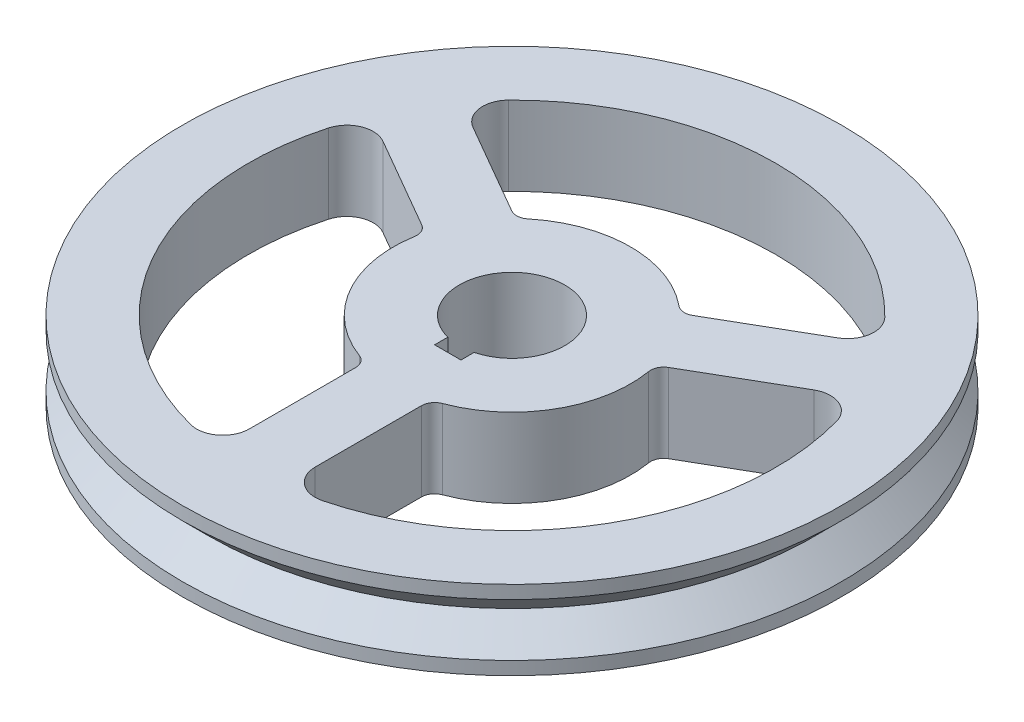
from build123d import *

# Parameters (mm, degrees)
SKETCH1_R           = 125
BOSS_EXTRUDE1_DEPTH = 15


with BuildPart() as part:
    # Sketch1 → Boss-Extrude1 (new, symmetric)
    with BuildSketch(Plane(origin=(0, 0, 0), x_dir=(1, 0, 0), z_dir=(0, 1, 0))):
        with Locations(Location((0, 0, 0), (0, 0, 270))):
            Circle(SKETCH1_R)
        with BuildLine():
            Line((34.312451849, 34.244060041), (69.217294241, 54.396380192))
            ThreePointArc((69.217294241, 54.396380192), (74.125688388, 61.706180446), (71.352549156, 70.062926922))
            ThreePointArc((71.352549156, 70.062926922), (0, 100), (-71.352549156, 70.062926922))
            ThreePointArc((-71.352549156, 70.062926922), (-74.125688388, 61.706180446), (-69.217294241, 54.396380192))
            Line((-69.217294241, 54.396380192), (-34.312451849, 34.244060041))
            ThreePointArc((-34.312451849, 34.244060041), (-31.397859232, 33.591405411), (-28.631206664, 34.716768354))
            ThreePointArc((-28.631206664, 34.716768354), (0, 45), (28.631206664, 34.716768354))
            ThreePointArc((28.631206664, 34.716768354), (31.397859232, 33.591405411), (34.312451849, 34.244060041))
        make_face(mode=Mode.SUBTRACT)
        with BuildLine():
            Line((-12.5, -46.837484988), (-12.5, -87.14212529))
            ThreePointArc((-12.5, -87.14212529), (-16.376275643, -95.04781944), (-25, -96.824583655))
            ThreePointArc((-25, -96.824583655), (-86.602540378, -50), (-96.352549156, 26.761656733))
            ThreePointArc((-96.352549156, 26.761656733), (-90.501964031, 33.341638994), (-81.717294241, 32.745745098))
            Line((-81.717294241, 32.745745098), (-46.812451849, 12.593424947))
            ThreePointArc((-46.812451849, 12.593424947), (-44.789940051, 10.395641014), (-44.381206664, 7.436968135))
            ThreePointArc((-44.381206664, 7.436968135), (-38.97114317, -22.5), (-15.75, -42.153736489))
            ThreePointArc((-15.75, -42.153736489), (-13.392080819, -43.987046425), (-12.5, -46.837484988))
        make_face(mode=Mode.SUBTRACT)
        with BuildLine():
            Line((12.5, -46.837484988), (12.5, -87.14212529))
            ThreePointArc((12.5, -87.14212529), (16.376275643, -95.04781944), (25, -96.824583655))
            ThreePointArc((25, -96.824583655), (86.602540378, -50), (96.352549156, 26.761656733))
            ThreePointArc((96.352549156, 26.761656733), (90.501964031, 33.341638994), (81.717294241, 32.745745098))
            Line((81.717294241, 32.745745098), (46.812451849, 12.593424947))
            ThreePointArc((46.812451849, 12.593424947), (44.789940051, 10.395641014), (44.381206664, 7.436968135))
            ThreePointArc((44.381206664, 7.436968135), (38.97114317, -22.5), (15.75, -42.153736489))
            ThreePointArc((15.75, -42.153736489), (13.392080819, -43.987046425), (12.5, -46.837484988))
        make_face(mode=Mode.SUBTRACT)
        with BuildLine():
            Line((-5, -19.364916731), (-5, -24.364916731))
            Line((-5, -24.364916731), (5, -24.364916731))
            Line((5, -24.364916731), (5, -19.364916731))
            ThreePointArc((5, -19.364916731), (0, 20), (-5, -19.364916731))
        make_face(mode=Mode.SUBTRACT)
    extrude(amount=BOSS_EXTRUDE1_DEPTH, both=True)

    # Sketch2 → Cut-Revolve1 (revolve, cut)
    with BuildSketch(Plane.XY, mode=Mode.PRIVATE) as cut_revolve1_sk:
        Polygon((-125, 10), (-125, -10), (-115, 0), align=None)
    revolve(cut_revolve1_sk.sketch.rotate(Axis((0, 35.426669207, 0), (0, -1, 0)), 270), axis=Axis((0, 35.426669207, 0), (0, -1, 0)), mode=Mode.SUBTRACT)


solid = part.part
